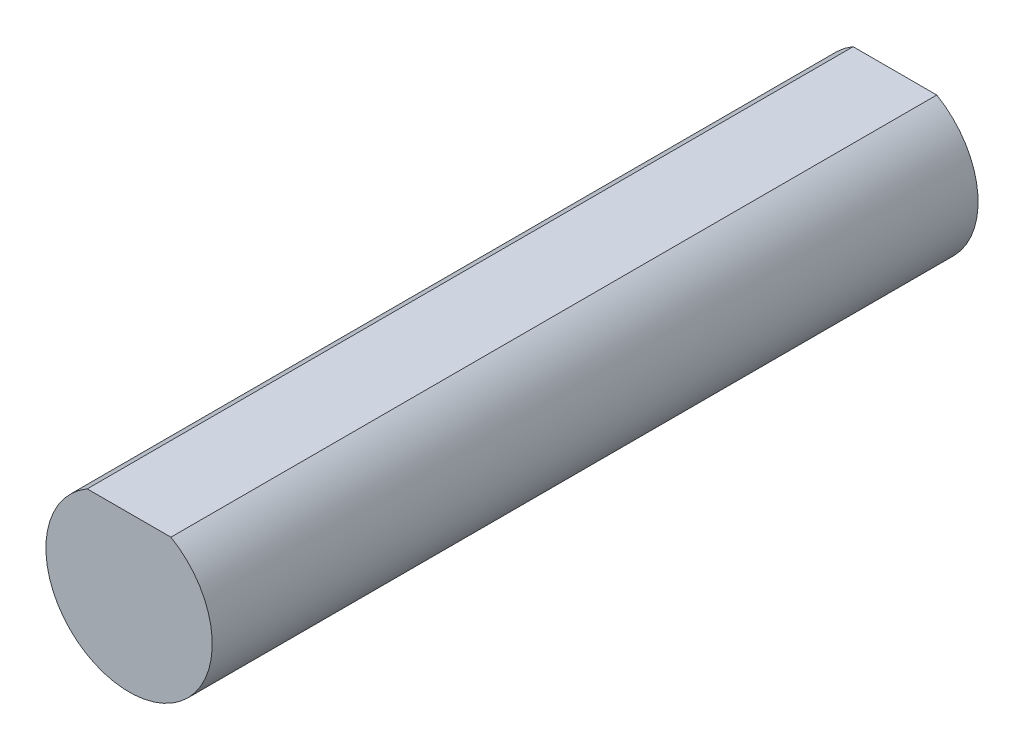
from build123d import *

# Parameters (mm, degrees)
BOSS_EXTRUDE1_DEPTH = 36.6


with BuildPart() as part:
    # Sketch1 → Boss-Extrude1 (new body)
    with BuildSketch(Plane.XY):
        with BuildLine():
            Line((2, 3.435203779), (-2, 3.435203779))
            ThreePointArc((-2, 3.435203779), (0, -3.975), (2, 3.435203779))
        make_face()
    extrude(amount=BOSS_EXTRUDE1_DEPTH)


solid = part.part
